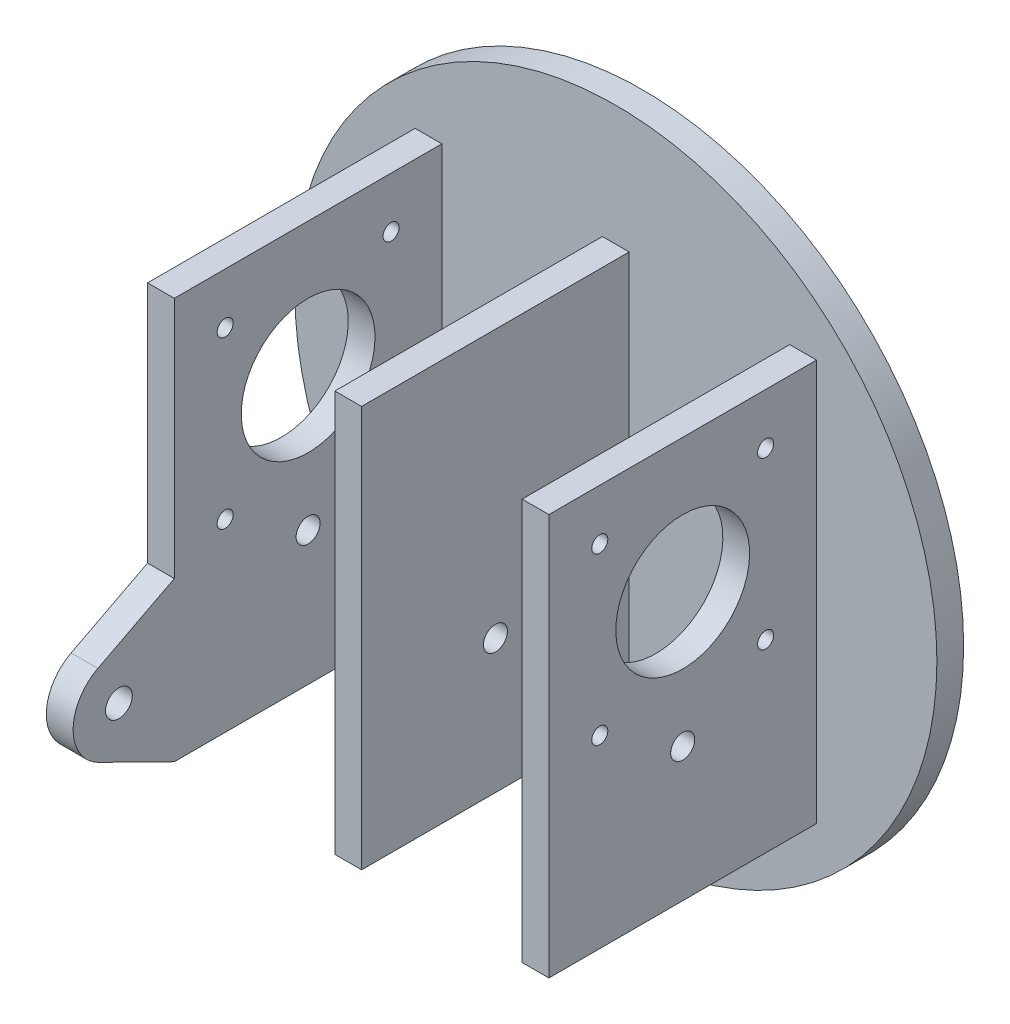
from build123d import *

# Parameters (mm, degrees)
SKETCH1_R               = 60
SKETCH1_R_2             = 1.5
BOSS_EXTRUDE1_DEPTH     = 5
SKETCH2_W               = 5
SKETCH2_H               = 75
BOSS_EXTRUDE2_DEPTH     = 50
SKETCH3_R               = 1.5
SKETCH3_R_2             = 12.5
CUT_EXTRUDE1_DEPTH      = 122.063000128
CUT_EXTRUDE4_DEPTH      = 101.031245119
CUT_EXTRUDE4_DEPTH_BACK = 53
SKETCH5_R               = 2.24506403
SKETCH6_R               = 1.5
SKETCH6_R_2             = 12.5
CUT_EXTRUDE5_DEPTH      = 5
SKETCH7_R               = 2.5
BOSS_EXTRUDE4_DEPTH     = 5
BODY_MOVE_COPY1_ANGLE   = 180


with BuildPart() as part:
    # Sketch1 → Boss-Extrude1 (new body)
    with BuildSketch(Plane.XY):
        Circle(SKETCH1_R)
        Circle(SKETCH1_R_2, mode=Mode.SUBTRACT)
    extrude(amount=BOSS_EXTRUDE1_DEPTH)

    # Sketch2 → Boss-Extrude2 (add)
    with BuildSketch(Plane(origin=(0, 0, 0), x_dir=(-1, 0, 0), z_dir=(0, 0, -1))):
        with Locations((-35, 0)):
            Rectangle(SKETCH2_W, SKETCH2_H)
        with Locations((35, 0)):
            Rectangle(SKETCH2_W, SKETCH2_H)
        Rectangle(SKETCH2_W, SKETCH2_H)
    extrude(amount=BOSS_EXTRUDE2_DEPTH)

    # Sketch3 → Cut-Extrude1 (cut, through all)
    with BuildSketch(Plane.ZY.offset(-32.5)):
        with Locations(Location((-40.5, 3, 0), (0, 0, 270))):
            Circle(SKETCH3_R)
        with Locations(Location((-9.5, 3, 0), (0, 0, 270))):
            Circle(SKETCH3_R)
        with Locations(Location((-9.5, -28, 0), (0, 0, 270))):
            Circle(SKETCH3_R)
        with Locations(Location((-40.5, -28, 0), (0, 0, 270))):
            Circle(SKETCH3_R)
        with Locations(Location((-25, -12.5, 0), (0, 0, 270))):
            Circle(SKETCH3_R_2)
    extrude(amount=-CUT_EXTRUDE1_DEPTH, mode=Mode.SUBTRACT)

    # Sketch5 → Cut-Extrude4 (cut, two sides: drawn at the far end of the back side and taken through both)
    with BuildSketch(Plane.ZY.offset(2.5).offset(-CUT_EXTRUDE4_DEPTH_BACK)):
        with Locations(Location((-25, 12.5, 0), (0, 0, 180))):
            Circle(SKETCH5_R)
    extrude(amount=CUT_EXTRUDE4_DEPTH + CUT_EXTRUDE4_DEPTH_BACK, mode=Mode.SUBTRACT)

    # Sketch6 → Cut-Extrude5 (cut)
    with BuildSketch(Plane.ZY.offset(37.5)):
        with Locations(Location((-40.5, 3, 0), (0, 0, 270))):
            Circle(SKETCH6_R)
        with Locations(Location((-9.5, 3, 0), (0, 0, 270))):
            Circle(SKETCH6_R)
        with Locations(Location((-9.5, -28, 0), (0, 0, 270))):
            Circle(SKETCH6_R)
        with Locations(Location((-40.5, -28, 0), (0, 0, 270))):
            Circle(SKETCH6_R)
        with Locations(Location((-25, -12.5, 0), (0, 0, 270))):
            Circle(SKETCH6_R_2)
    extrude(amount=-CUT_EXTRUDE5_DEPTH, mode=Mode.SUBTRACT)

    # Sketch7 → Boss-Extrude4 (add)
    with BuildSketch(Plane.ZY.offset(37.5)):
        with BuildLine():
            Line((-50, 37.5), (-64.138546099, 30.534707883))
            ThreePointArc((-64.138546099, 30.534707883), (-68.91560159, 22.940582469), (-64.290723579, 15.252832254))
            Line((-64.290723579, 15.252832254), (-50, 7.855339059))
            Line((-50, 7.855339059), (-50, 37.5))
        make_face()
        with Locations(Location((-60.355339059, 22.855339059, 0), (0, 0, 270))):
            Circle(SKETCH7_R, mode=Mode.SUBTRACT)
    extrude(amount=-BOSS_EXTRUDE4_DEPTH)


with BuildPart() as part_1:
    # Body-Move/Copy1: moved
    add(part.part.rotate(Axis((0, 0, -31.958013004), (1, 0, 0)), BODY_MOVE_COPY1_ANGLE))


with BuildPart() as part_2:
    # Body-Move/Copy2: moved
    add(part_1.part.moved(Location((0, 0, 68.91602601))))


solid = part_2.part
